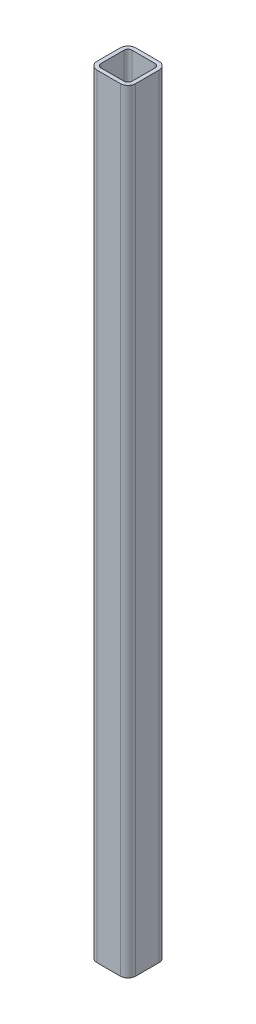
from build123d import *

# Parameters (mm, degrees)
SQUARE_TUBE_40_X_40_X_4_1_DEPTH = 800


with BuildPart() as part:
    # Sketch11 → Square tube 40 X 40 X 4(1) (new body)
    with BuildSketch(Plane(origin=(0, 0, 0), x_dir=(0, 0, -1), z_dir=(0, -1, 0))):
        with BuildLine():
            Line((-12, -20), (12, -20))
            ThreePointArc((12, -20), (17.656854249, -17.656854249), (20, -12))
            Line((20, -12), (20, 12))
            ThreePointArc((20, 12), (17.656854249, 17.656854249), (12, 20))
            Line((12, 20), (-12, 20))
            ThreePointArc((-12, 20), (-17.656854249, 17.656854249), (-20, 12))
            Line((-20, 12), (-20, -12))
            ThreePointArc((-20, -12), (-17.656854249, -17.656854249), (-12, -20))
        make_face()
        with BuildLine():
            Line((-12, -16), (12, -16))
            ThreePointArc((12, -16), (14.828427125, -14.828427125), (16, -12))
            Line((16, -12), (16, 12))
            ThreePointArc((16, 12), (14.828427125, 14.828427125), (12, 16))
            Line((12, 16), (-12, 16))
            ThreePointArc((-12, 16), (-14.828427125, 14.828427125), (-16, 12))
            Line((-16, 12), (-16, -12))
            ThreePointArc((-16, -12), (-14.828427125, -14.828427125), (-12, -16))
        make_face(mode=Mode.SUBTRACT)
    extrude(amount=SQUARE_TUBE_40_X_40_X_4_1_DEPTH)


solid = part.part
